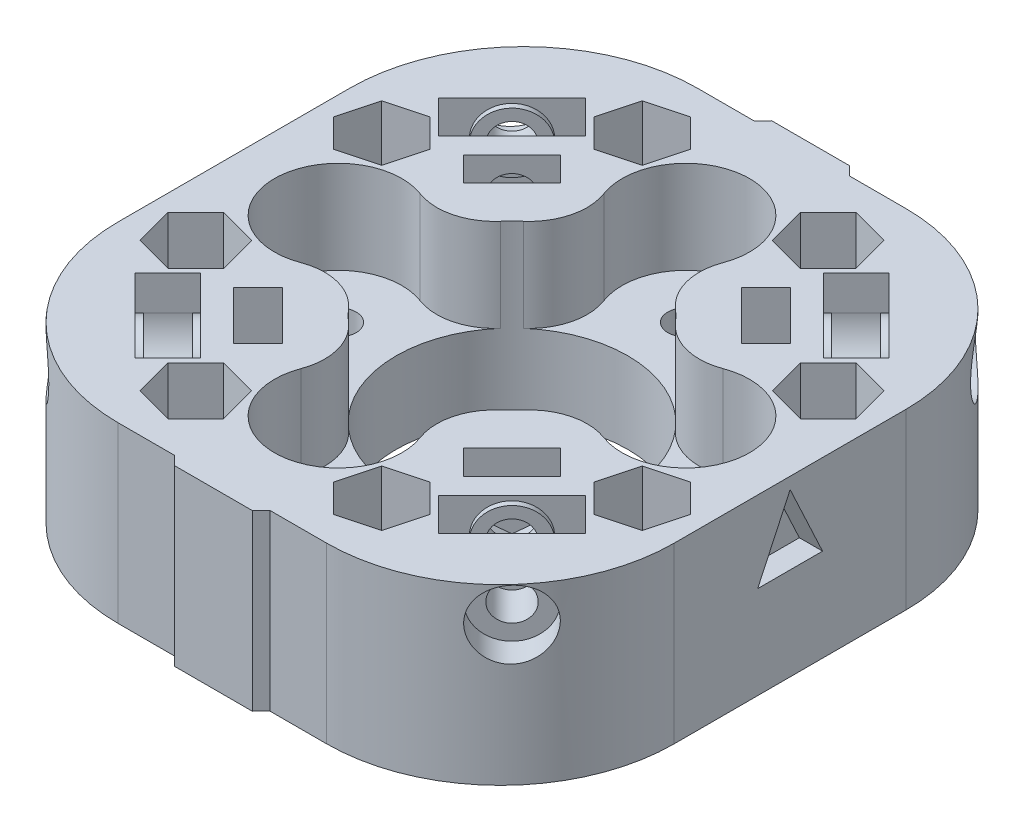
from build123d import *
from build123d.topology import SkipClean

# Parameters (mm, degrees)
SALIENTE_EXTRUIR1_DEPTH = 15
BOSS_EXTRUDE1_DEPTH     = 15
CORTAR_EXTRUIR1_DEPTH   = 4
CORTAR_EXTRUIR2_DEPTH   = 3
CROQUIS5_R              = 1.6
CORTAR_EXTRUIR3_DEPTH   = 55.319838485
CROQUIS8_R              = 2.95
CORTAR_EXTRUIR5_DEPTH   = 4
CROQUIS10_R             = 2.6
CROQUIS10_R_2           = 1.6
SALIENTE_EXTRUIR2_DEPTH = 0.5
SALIENTE_EXTRUIR3_START = 0.5
CROQUIS11_R             = 2.6
CROQUIS11_R_2           = 1.6
SALIENTE_EXTRUIR3_DEPTH = 0.5
CROQUIS12_R             = 10
CROQUIS12_R_2           = 1.55
CORTAR_EXTRUIR6_DEPTH   = 39.276532076
CORTAR_EXTRUIR7_START   = -8
CROQUIS13_R             = 1.55
CORTAR_EXTRUIR7_DEPTH   = 8
MATRIZC1_COUNT          = 4
CROQUIS14_R             = 2.95
CORTAR_EXTRUIR8_DEPTH   = 3
MATRIZC2_COUNT          = 4
CROQUIS15_R             = 1.5
CORTAR_EXTRUIR9_DEPTH   = 5
MATRIZC3_COUNT          = 4
CROQUIS16_R             = 1.6
CORTAR_EXTRUIR10_DEPTH  = 10
CROQUIS17_R             = 1.6
CORTAR_EXTRUIR11_DEPTH  = 39.276532076
MATRIZC4_COUNT          = 4
CUT_EXTRUDE10_DEPTH     = 2


with BuildPart() as part:
    # Croquis1 → Saliente-Extruir1 (new body)
    with BuildSketch(Plane(origin=(0, 0, 0), x_dir=(1, 0, 0), z_dir=(0, 1, 0))):
        with BuildLine():
            Line((3.36, 25.77), (-3.36, 25.77))
            Line((-3.36, 25.77), (-4.543554853, 24.583655328))
            ThreePointArc((-4.543554853, 24.583655328), (-16.762454014, 18.547779798), (-24, 7))
            Line((-24, 7), (-24, -7))
            ThreePointArc((-24, -7), (-16.762454014, -18.547779798), (-4.543554853, -24.583655328))
            Line((-4.543554853, -24.583655328), (-3.36, -25.77))
            Line((-3.36, -25.77), (3.36, -25.77))
            Line((3.36, -25.77), (4.543554853, -24.583655328))
            ThreePointArc((4.543554853, -24.583655328), (16.762454014, -18.547779798), (24, -7))
            Line((24, -7), (24, 7))
            ThreePointArc((24, 7), (16.762454014, 18.547779798), (4.543554853, 24.583655328))
            Line((4.543554853, 24.583655328), (3.36, 25.77))
        make_face()
    extrude(amount=SALIENTE_EXTRUIR1_DEPTH)

    # Sketch1 → Boss-Extrude1 (add)
    with BuildSketch(Plane.XZ):
        with BuildLine():
            Line((-9, -25), (9, -25))
            ThreePointArc((9, -25), (19.606601718, -20.606601718), (24, -10))
            Line((24, -10), (24, 10))
            ThreePointArc((24, 10), (19.606601718, 20.606601718), (9, 25))
            Line((9, 25), (-9, 25))
            ThreePointArc((-9, 25), (-19.606601718, 20.606601718), (-24, 10))
            Line((-24, 10), (-24, -10))
            ThreePointArc((-24, -10), (-19.606601718, -20.606601718), (-9, -25))
        make_face()
    extrude(amount=-BOSS_EXTRUDE1_DEPTH)

    # Croquis3 → Cortar-Extruir1 (cut)
    with BuildSketch(Plane(origin=(16.263455967, 0, -16.263455967), x_dir=(0.7071067811865477, 0, 0.7071067811865475), z_dir=(-0.7071067811865475, 0, 0.7071067811865477))):
        with BuildLine():
            Line((-4.5, 12), (-4.5, 15))
            Line((-4.5, 15), (4.5, 15))
            Line((4.5, 15), (4.5, 12))
            ThreePointArc((4.5, 12), (0, 7.5), (-4.5, 12))
        make_face()
    cortar_extruir1 = extrude(amount=CORTAR_EXTRUIR1_DEPTH, mode=Mode.SUBTRACT)

    # Croquis4 → Cortar-Extruir2 (cut)
    with BuildSketch(Plane(origin=(12.02081528, 0, -12.02081528), x_dir=(-0.7071067811865476, 0, -0.7071067811865476), z_dir=(0.7071067811865476, 0, -0.7071067811865476))):
        Polygon((-2.95, 10.296816706), (0, 8.593633412), (2.95, 10.296816706), (2.95, 13.703183294), (2.95, 15), (-2.95, 15), (-2.95, 13.703183294), align=None)
    cortar_extruir2 = extrude(amount=-CORTAR_EXTRUIR2_DEPTH, mode=Mode.SUBTRACT)

    # Croquis5 → Cortar-Extruir3 (cut, through all)
    with BuildSketch(Plane(origin=(12.02081528, 0, -12.02081528), x_dir=(0.7071067811865475, 0, 0.7071067811865477), z_dir=(-0.7071067811865477, 0, 0.7071067811865475))):
        with Locations((0, 12)):
            Circle(CROQUIS5_R)
    cortar_extruir3 = extrude(amount=-CORTAR_EXTRUIR3_DEPTH, mode=Mode.SUBTRACT)

    # Croquis8 → Cortar-Extruir5 (cut)
    with BuildSketch(Plane(origin=(21.213203436, 0, -21.213203436), x_dir=(-0.7071067811865476, 0, -0.7071067811865476), z_dir=(0.7071067811865476, 0, -0.7071067811865476))):
        with Locations((0, 12)):
            Circle(CROQUIS8_R)
    cortar_extruir5 = extrude(amount=-CORTAR_EXTRUIR5_DEPTH, mode=Mode.SUBTRACT)

    # Croquis10 → Saliente-Extruir2 (add)
    with BuildSketch(Plane(origin=(13.435028843, 0, -13.435028843), x_dir=(-0.7071067811865476, 0, -0.7071067811865476), z_dir=(0.7071067811865476, 0, -0.7071067811865476))):
        with Locations(Location((0, 12, 0), (0, 0, 180))):
            Circle(CROQUIS10_R)
        with Locations(Location((0, 12, 0), (0, 0, 180))):
            Circle(CROQUIS10_R_2, mode=Mode.SUBTRACT)
    saliente_extruir2 = extrude(amount=SALIENTE_EXTRUIR2_DEPTH)

    # Croquis11 → Saliente-Extruir3 (add)
    with BuildSketch(Plane(origin=(16.263455967, 0, -16.263455967), x_dir=(0.7071067811865476, 0, 0.7071067811865476), z_dir=(-0.7071067811865476, 0, 0.7071067811865476)).offset(SALIENTE_EXTRUIR3_START)):
        with Locations((0, 12)):
            Circle(CROQUIS11_R)
        with Locations((0, 12)):
            Circle(CROQUIS11_R_2, mode=Mode.SUBTRACT)
    saliente_extruir3 = extrude(amount=-SALIENTE_EXTRUIR3_DEPTH)

    # Croquis12 → Cortar-Extruir6 (cut, through all)
    with BuildSketch(Plane.XZ):
        with Locations(Location((0, 0, 0), (0, 0, 270))):
            Circle(CROQUIS12_R)
        with Locations(Location((0, -15, 0), (0, 0, 270))):
            Circle(CROQUIS12_R_2)
        with Locations(Location((-15, 0, 0), (0, 0, 270))):
            Circle(CROQUIS12_R_2)
        with Locations(Location((0, 15, 0), (0, 0, 270))):
            Circle(CROQUIS12_R_2)
        with Locations(Location((15, 0, 0), (0, 0, 270))):
            Circle(CROQUIS12_R_2)
    extrude(amount=-CORTAR_EXTRUIR6_DEPTH, mode=Mode.SUBTRACT)

    # Croquis13 → Cortar-Extruir7 (cut)
    # profile 1 of 5: a face of its own
    with SkipClean():  # the faces are left unmerged after this step: merging them gives an invalid solid
        with BuildSketch(Plane(origin=(0, 15, 0), x_dir=(1, 0, 0), z_dir=(0, 1, 0)).offset(CORTAR_EXTRUIR7_START)):
            with BuildLine():
                ThreePointArc((-6.557247898, 7.55), (0, 10), (6.557247898, 7.55))
                ThreePointArc((6.557247898, 7.55), (4.990126291, 10.092624246), (5.152123349, 13.075))
                ThreePointArc((5.152123349, 13.075), (0, 20.5), (-5.152123349, 13.075))
                ThreePointArc((-5.152123349, 13.075), (-4.990126291, 10.092624246), (-6.557247898, 7.55))
            make_face()
            with Locations(Location((0, 15, 0), (0, 0, 90))):
                Circle(CROQUIS13_R, mode=Mode.SUBTRACT)
        # profile 2 of 5: a face of its own
        with BuildSketch(Plane(origin=(0, 15, 0), x_dir=(1, 0, 0), z_dir=(0, 1, 0)).offset(CORTAR_EXTRUIR7_START)):
            with BuildLine():
                ThreePointArc((6.557247898, -7.55), (7.071067812, -7.071067812), (7.55, -6.557247898))
                ThreePointArc((7.55, -6.557247898), (9.367496998, -3.5), (10, 0))
                ThreePointArc((10, 0), (9.367496998, 3.5), (7.55, 6.557247898))
                ThreePointArc((7.55, 6.557247898), (7.071067812, 7.071067812), (6.557247898, 7.55))
                ThreePointArc((6.557247898, 7.55), (0, 10), (-6.557247898, 7.55))
                ThreePointArc((-6.557247898, 7.55), (-7.071067812, 7.071067812), (-7.55, 6.557247898))
                ThreePointArc((-7.55, 6.557247898), (-10, 0), (-7.55, -6.557247898))
                ThreePointArc((-7.55, -6.557247898), (-7.071067812, -7.071067812), (-6.557247898, -7.55))
                ThreePointArc((-6.557247898, -7.55), (0, -10), (6.557247898, -7.55))
            make_face()
        # profile 3 of 5: a face of its own
        with BuildSketch(Plane(origin=(0, 15, 0), x_dir=(1, 0, 0), z_dir=(0, 1, 0)).offset(CORTAR_EXTRUIR7_START)):
            with BuildLine():
                ThreePointArc((5.152123349, -13.075), (4.990126291, -10.092624246), (6.557247898, -7.55))
                ThreePointArc((6.557247898, -7.55), (0, -10), (-6.557247898, -7.55))
                ThreePointArc((-6.557247898, -7.55), (-4.990126291, -10.092624246), (-5.152123349, -13.075))
                ThreePointArc((-5.152123349, -13.075), (0, -20.5), (5.152123349, -13.075))
            make_face()
            with Locations(Location((0, -15, 0), (0, 0, 90))):
                Circle(CROQUIS13_R, mode=Mode.SUBTRACT)
        # profile 4 of 5: a face of its own
        with BuildSketch(Plane(origin=(0, 15, 0), x_dir=(1, 0, 0), z_dir=(0, 1, 0)).offset(CORTAR_EXTRUIR7_START)):
            with BuildLine():
                ThreePointArc((-13.075, -5.152123349), (-10.092624246, -4.990126291), (-7.55, -6.557247898))
                ThreePointArc((-7.55, -6.557247898), (-10, 0), (-7.55, 6.557247898))
                ThreePointArc((-7.55, 6.557247898), (-10.092624246, 4.990126291), (-13.075, 5.152123349))
                ThreePointArc((-13.075, 5.152123349), (-20.5, 0), (-13.075, -5.152123349))
            make_face()
            with Locations(Location((-15, 0, 0), (0, 0, 90))):
                Circle(CROQUIS13_R, mode=Mode.SUBTRACT)
        # profile 5 of 5: a face of its own
        with BuildSketch(Plane(origin=(0, 15, 0), x_dir=(1, 0, 0), z_dir=(0, 1, 0)).offset(CORTAR_EXTRUIR7_START)):
            with BuildLine():
                ThreePointArc((7.55, -6.557247898), (10.092624246, -4.990126291), (13.075, -5.152123349))
                ThreePointArc((13.075, -5.152123349), (20.5, 0), (13.075, 5.152123349))
                ThreePointArc((13.075, 5.152123349), (10.092624246, 4.990126291), (7.55, 6.557247898))
                ThreePointArc((7.55, 6.557247898), (9.367496998, 3.5), (10, 0))
                ThreePointArc((10, 0), (9.367496998, -3.5), (7.55, -6.557247898))
            make_face()
            with Locations(Location((15, 0, 0), (0, 0, 90))):
                Circle(CROQUIS13_R, mode=Mode.SUBTRACT)
        extrude(amount=CORTAR_EXTRUIR7_DEPTH, mode=Mode.SUBTRACT)

    # MatrizC1: Cortar-Extruir1, Cortar-Extruir2, Cortar-Extruir3, Cortar-Extruir5, Saliente-Extruir2, Saliente-Extruir3 ×4 about axis
    with SkipClean():  # the faces are left unmerged after this step: merging them gives an invalid solid
        matrizc1_axis = Axis((0, 0, 0), (0, 1, 0))
        add([cortar_extruir1.rotate(matrizc1_axis, i * 360 / MATRIZC1_COUNT) for i in range(1, MATRIZC1_COUNT)], mode=Mode.SUBTRACT)
        add([cortar_extruir2.rotate(matrizc1_axis, i * 360 / MATRIZC1_COUNT) for i in range(1, MATRIZC1_COUNT)], mode=Mode.SUBTRACT)
        add([cortar_extruir3.rotate(matrizc1_axis, i * 360 / MATRIZC1_COUNT) for i in range(1, MATRIZC1_COUNT)], mode=Mode.SUBTRACT)
        add([cortar_extruir5.rotate(matrizc1_axis, i * 360 / MATRIZC1_COUNT) for i in range(1, MATRIZC1_COUNT)], mode=Mode.SUBTRACT)
        add([saliente_extruir2.rotate(matrizc1_axis, i * 360 / MATRIZC1_COUNT) for i in range(1, MATRIZC1_COUNT)])
        add([saliente_extruir3.rotate(matrizc1_axis, i * 360 / MATRIZC1_COUNT) for i in range(1, MATRIZC1_COUNT)])

    # Croquis14 → Cortar-Extruir8 (cut)
    with SkipClean():  # the faces are left unmerged after this step: merging them gives an invalid solid
        with BuildSketch(Plane.XZ):
            with Locations(Location((0, -15, 0), (0, 0, 270))):
                Circle(CROQUIS14_R)
        cortar_extruir8 = extrude(amount=-CORTAR_EXTRUIR8_DEPTH, mode=Mode.SUBTRACT)

    # MatrizC2: Cortar-Extruir8 ×4 about axis
    with SkipClean():  # the faces are left unmerged after this step: merging them gives an invalid solid
        matrizc2_axis = Axis((0, 0, 0), (0, 1, 0))
        for i in range(1, MATRIZC2_COUNT):
            add(cortar_extruir8.rotate(matrizc2_axis, i * 360 / MATRIZC2_COUNT), mode=Mode.SUBTRACT)

    # Croquis15 → Cortar-Extruir9 (cut)
    with SkipClean():  # the faces are left unmerged after this step: merging them gives an invalid solid
        with BuildSketch(Plane.XZ):
            with Locations(Location((-10.606601718, 10.606601718, 0), (0, 0, 270))):
                Circle(CROQUIS15_R)
        cortar_extruir9 = extrude(amount=-CORTAR_EXTRUIR9_DEPTH, mode=Mode.SUBTRACT)

    # MatrizC3: Cortar-Extruir9 ×4 about axis
    with SkipClean():  # the faces are left unmerged after this step: merging them gives an invalid solid
        matrizc3_axis = Axis((0, 0, 0), (0, 1, 0))
        for i in range(1, MATRIZC3_COUNT):
            add(cortar_extruir9.rotate(matrizc3_axis, i * 360 / MATRIZC3_COUNT), mode=Mode.SUBTRACT)

    # Croquis16 → Cortar-Extruir10 (cut)
    # profile 1 of 2: a face of its own
    with SkipClean():  # the faces are left unmerged after this step: merging them gives an invalid solid
        with BuildSketch(Plane(origin=(0, 15, 0), x_dir=(1, 0, 0), z_dir=(0, 1, 0))):
            Polygon((-4.733113576, 20.148041406), (-7.14177849, 22.55670632), (-10.432075951, 21.675073772), (-11.313708499, 18.384776311), (-8.905043585, 15.976111397), (-5.614746124, 16.857743945), align=None)
            with Locations(Location((-8.023411038, 19.266408858, 0), (0, 0, 270))):
                Circle(CROQUIS16_R, mode=Mode.SUBTRACT)
        # profile 2 of 2: a face of its own
        with BuildSketch(Plane(origin=(0, 15, 0), x_dir=(1, 0, 0), z_dir=(0, 1, 0))):
            Polygon((-18.384776311, 11.313708499), (-21.675073772, 10.432075951), (-22.55670632, 7.14177849), (-20.148041406, 4.733113576), (-16.857743945, 5.614746124), (-15.976111397, 8.905043585), align=None)
            with Locations(Location((-19.266408858, 8.023411038, 0), (0, 0, 270))):
                Circle(CROQUIS16_R, mode=Mode.SUBTRACT)
        cortar_extruir10 = extrude(amount=-CORTAR_EXTRUIR10_DEPTH, mode=Mode.SUBTRACT)

    # Croquis17 → Cortar-Extruir11 (cut, through all)
    with SkipClean():  # the faces are left unmerged after this step: merging them gives an invalid solid
        with BuildSketch(Plane(origin=(0, 15, 0), x_dir=(1, 0, 0), z_dir=(0, 1, 0))):
            with Locations(Location((-19.266408858, 8.023411038, 0), (0, 0, 270))):
                Circle(CROQUIS17_R)
            with Locations(Location((-8.023411038, 19.266408858, 0), (0, 0, 270))):
                Circle(CROQUIS17_R)
        cortar_extruir11 = extrude(amount=-CORTAR_EXTRUIR11_DEPTH, mode=Mode.SUBTRACT)

    # MatrizC4: Cortar-Extruir10, Cortar-Extruir11 ×4 about axis
    with SkipClean():  # the faces are left unmerged after this step: merging them gives an invalid solid
        matrizc4_axis = Axis((0, 0, 0), (0, 1, 0))
        add([cortar_extruir10.rotate(matrizc4_axis, i * 360 / MATRIZC4_COUNT) for i in range(1, MATRIZC4_COUNT)], mode=Mode.SUBTRACT)
        add([cortar_extruir11.rotate(matrizc4_axis, i * 360 / MATRIZC4_COUNT) for i in range(1, MATRIZC4_COUNT)], mode=Mode.SUBTRACT)

    # Sketch2 → Cut-Extrude10 (cut)
    with SkipClean():  # the faces are left unmerged after this step: merging them gives an invalid solid
        with BuildSketch(Plane(origin=(24, 0, 0), x_dir=(0, 0, -1), z_dir=(1, 0, 0))):
            Polygon((0, 14), (-2.8, 8), (2.8, 8), align=None)
        extrude(amount=-CUT_EXTRUDE10_DEPTH, mode=Mode.SUBTRACT)


solid = part.part
